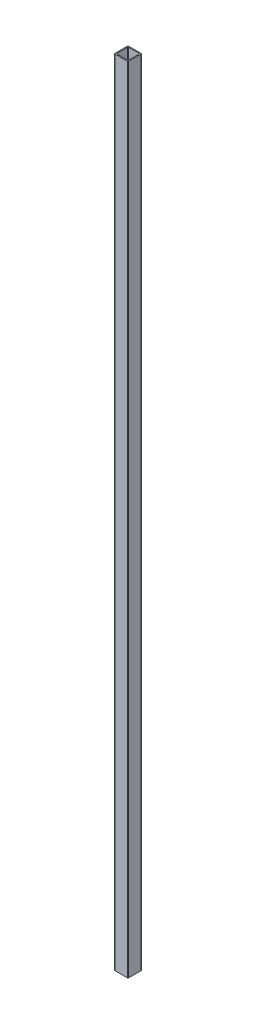
from build123d import *

# Parameters (mm, degrees)
BOSS_EXTRUDE1_DEPTH = 1160


with BuildPart() as part:
    # Sketch1 → Boss-Extrude1 (new body)
    with BuildSketch(Plane(origin=(0, 0, 0), x_dir=(1, 0, 0), z_dir=(0, 1, 0))):
        with BuildLine():
            Line((-9, -10), (9, -10))
            ThreePointArc((9, -10), (9.707106781, -9.707106781), (10, -9))
            Line((10, -9), (10, 9))
            ThreePointArc((10, 9), (9.707106781, 9.707106781), (9, 10))
            Line((9, 10), (-9, 10))
            ThreePointArc((-9, 10), (-9.707106781, 9.707106781), (-10, 9))
            Line((-10, 9), (-10, -9))
            ThreePointArc((-10, -9), (-9.707106781, -9.707106781), (-9, -10))
        make_face()
        with BuildLine():
            Line((-7.5, -8.5), (7.5, -8.5))
            ThreePointArc((7.5, -8.5), (8.207106781, -8.207106781), (8.5, -7.5))
            Line((8.5, -7.5), (8.5, 7.5))
            ThreePointArc((8.5, 7.5), (8.207106781, 8.207106781), (7.5, 8.5))
            Line((7.5, 8.5), (-7.5, 8.5))
            ThreePointArc((-7.5, 8.5), (-8.207106781, 8.207106781), (-8.5, 7.5))
            Line((-8.5, 7.5), (-8.5, -7.5))
            ThreePointArc((-8.5, -7.5), (-8.207106781, -8.207106781), (-7.5, -8.5))
        make_face(mode=Mode.SUBTRACT)
    extrude(amount=BOSS_EXTRUDE1_DEPTH)


solid = part.part
